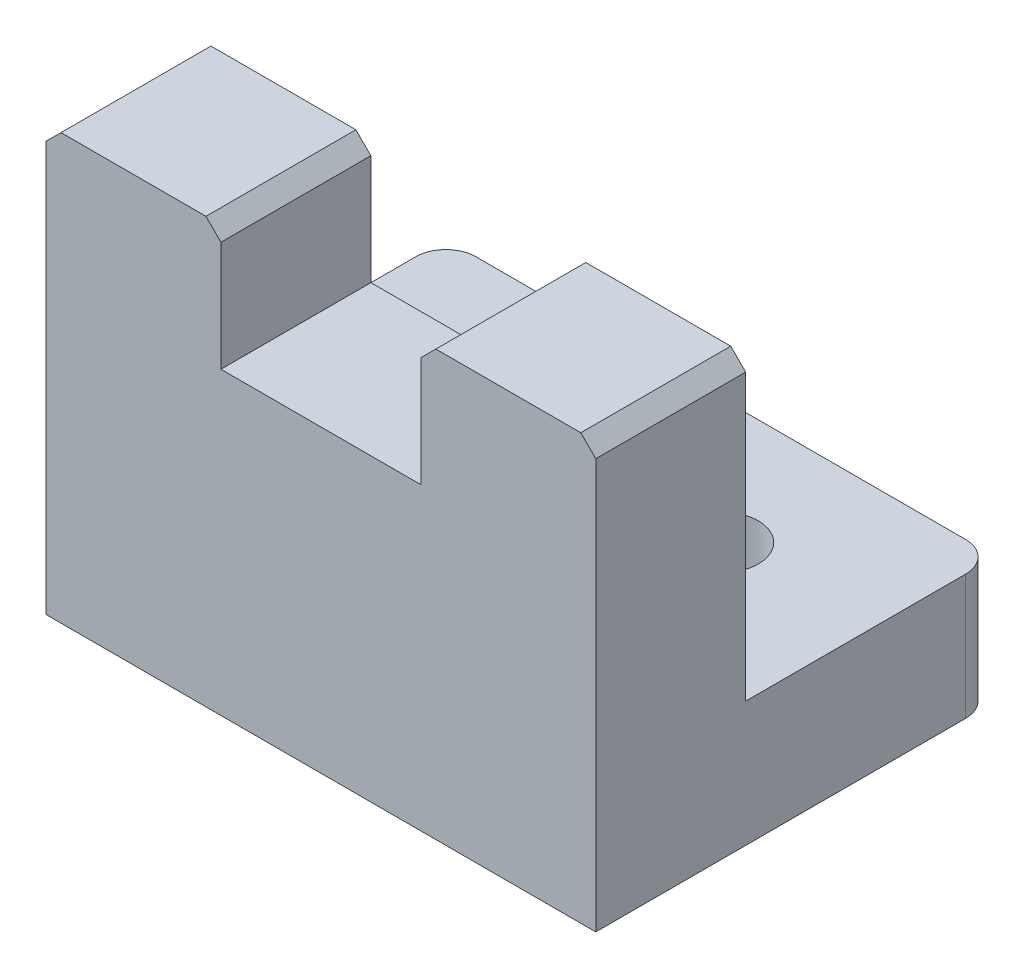
from build123d import *

# Parameters (mm, degrees)
SKETCH1_W             = 110
SKETCH1_H             = 80
BOSS_EXTRUDE1_DEPTH   = 12.5
SKETCH2_W             = 110
SKETCH2_H             = 30
BOSS_EXTRUDE2_DEPTH   = 60
SKETCH3_W             = 40
SKETCH3_H             = 25
CUT_EXTRUDE1_DEPTH    = 104.832798286
CHAMFER1_SIZE         = 3
FILLET1_R             = 6
F_1_0MM_DOWEL_HOLE1_D = 15


with BuildPart() as part:
    # Sketch1 → Boss-Extrude1 (new, symmetric)
    with BuildSketch(Plane(origin=(0, 0, 0), x_dir=(1, 0, 0), z_dir=(0, 1, 0))):
        Rectangle(SKETCH1_W, SKETCH1_H)
    extrude(amount=BOSS_EXTRUDE1_DEPTH, both=True)

    # Sketch2 → Boss-Extrude2 (add)
    with BuildSketch(Plane(origin=(0, 12.5, 0), x_dir=(1, 0, 0), z_dir=(0, 1, 0))):
        with Locations((0, -25)):
            Rectangle(SKETCH2_W, SKETCH2_H)
    extrude(amount=BOSS_EXTRUDE2_DEPTH)

    # Sketch3 → Cut-Extrude1 (cut, through all)
    with BuildSketch(Plane(origin=(0, 0, 10), x_dir=(-1, 0, 0), z_dir=(0, 0, -1))):
        with Locations((0, 60)):
            Rectangle(SKETCH3_W, SKETCH3_H)
    extrude(amount=-CUT_EXTRUDE1_DEPTH, mode=Mode.SUBTRACT)

    # Chamfer1
    chamfer1_edges = [part.edges().sort_by_distance(p)[0] for p in [
        (-55, 72.5, 25),
        (55, 72.5, 25),
        (20, 72.5, 25),
        (-20, 72.5, 25),
    ]]
    chamfer(chamfer1_edges, length=CHAMFER1_SIZE)

    # Fillet1
    fillet1_edges = [part.edges().sort_by_distance(p)[0] for p in [
        (-55, 0, -40),
        (55, 0, -40),
    ]]
    fillet(fillet1_edges, radius=FILLET1_R)

    # Ø1.0mm Dowel Hole1 (through all)
    with Locations(Plane(origin=(0, 12.5, 0), x_dir=(1, 0, 0), z_dir=(0, 1, 0))):
        with Locations((25, 15), (-25, 15)):
            Hole(F_1_0MM_DOWEL_HOLE1_D / 2)


solid = part.part
